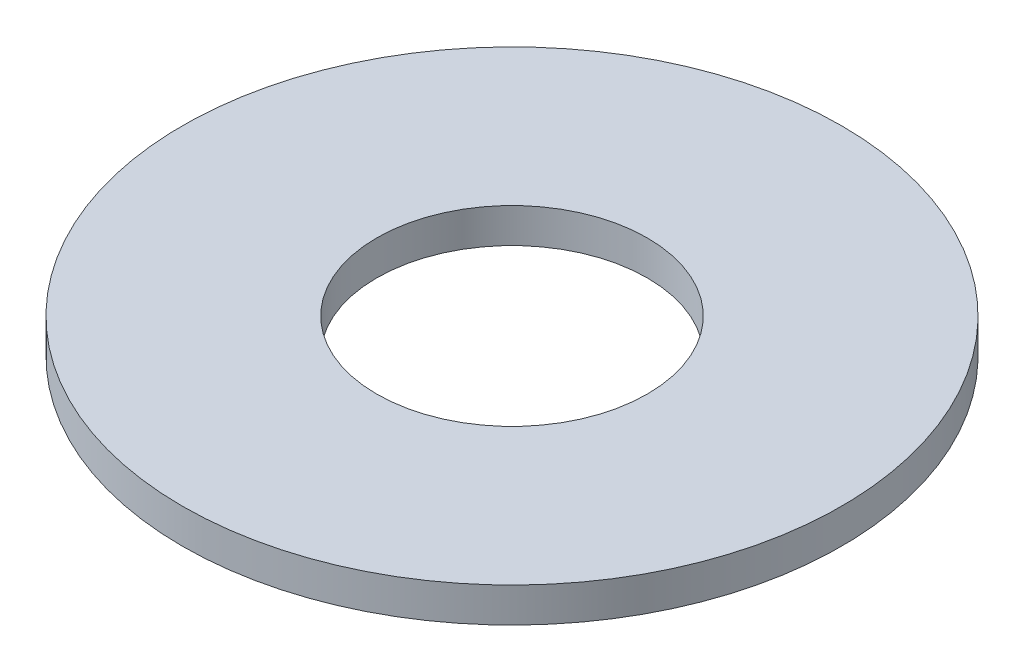
from build123d import *

# Parameters (mm, degrees)
SKETCH1_R           = 38
SKETCH1_R_2         = 15.6
BOSS_EXTRUDE1_DEPTH = 4


with BuildPart() as part:
    # Sketch1 → Boss-Extrude1 (new body)
    with BuildSketch(Plane(origin=(0, 0, 0), x_dir=(1, 0, 0), z_dir=(0, 1, 0))):
        with Locations(Location((0, 0, 0), (0, 0, 270))):
            Circle(SKETCH1_R)
        with Locations(Location((0, 0, 0), (0, 0, 270))):
            Circle(SKETCH1_R_2, mode=Mode.SUBTRACT)
    extrude(amount=BOSS_EXTRUDE1_DEPTH)


solid = part.part
